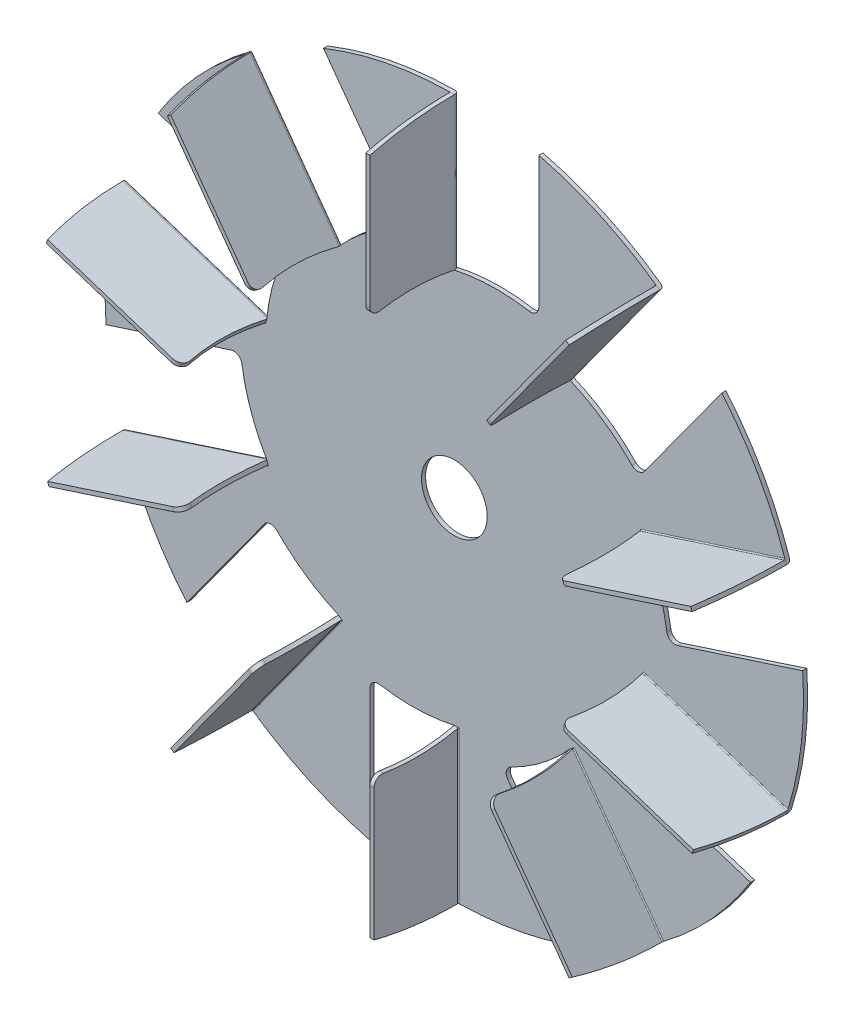
from build123d import *

# Parameters (mm, degrees)
SKETCH1_R           = 4
BOSS_EXTRUDE1_DEPTH = 0.5
BOSS_EXTRUDE2_DEPTH = 0.5
CIRPATTERN1_COUNT   = 10
FILLET1_R           = 1
FILLET2_R           = 1
FILLET3_R           = 0.4
FILLET4_R           = 0.125


with BuildPart() as part:
    # Sketch1 → Boss-Extrude1 (new body)
    with BuildSketch(Plane.XY):
        with BuildLine():
            ThreePointArc((0, 42.5), (-8.109382304, 41.719155297), (-15.92078022, 39.405313819))
            Line((-15.92078022, 39.405313819), (-5.788791749, 25.459828069))
            ThreePointArc((-5.788791749, 25.459828069), (-10.277538194, 22.89193764), (-14.106846055, 19.416407865))
            Line((-14.106846055, 19.416407865), (-24.980873222, 34.383222261))
            ThreePointArc((-24.980873222, 34.383222261), (-31.082532319, 28.984930303), (-36.042044087, 22.52156873))
            Line((-36.042044087, 22.52156873), (-19.648142366, 17.194867163))
            ThreePointArc((-19.648142366, 17.194867163), (-21.7702464, 12.478981204), (-22.825356391, 7.416407865))
            Line((-22.825356391, 7.416407865), (-40.419901943, 13.133222261))
            ThreePointArc((-40.419901943, 13.133222261), (-42.183211445, 5.179447095), (-42.396472136, -2.964650134))
            Line((-42.396472136, -2.964650134), (-26.002570416, 2.362051433))
            ThreePointArc((-26.002570416, 2.362051433), (-24.947460425, -2.700521906), (-22.825356391, -7.416407865))
            Line((-22.825356391, -7.416407865), (-40.419901943, -13.133222261))
            ThreePointArc((-40.419901943, -13.133222261), (-37.171337553, -20.60440886), (-32.556888833, -27.318473412))
            Line((-32.556888833, -27.318473412), (-22.424900361, -13.372987661))
            ThreePointArc((-22.424900361, -13.372987661), (-18.5955925, -16.848517436), (-14.106846055, -19.416407865))
            Line((-14.106846055, -19.416407865), (-24.980873222, -34.383222261))
            ThreePointArc((-24.980873222, -34.383222261), (-17.961276124, -38.518080949), (-10.281680563, -41.237568367))
            Line((-10.281680563, -41.237568367), (-10.281680563, -24))
            ThreePointArc((-10.281680563, -24), (-5.140840281, -24.560951965), (0, -24))
            Line((0, -24), (0, -42.5))
            ThreePointArc((0, -42.5), (8.109382304, -41.719155297), (15.92078022, -39.405313819))
            Line((15.92078022, -39.405313819), (5.788791749, -25.459828069))
            ThreePointArc((5.788791749, -25.459828069), (10.277538194, -22.89193764), (14.106846055, -19.416407865))
            Line((14.106846055, -19.416407865), (24.980873222, -34.383222261))
            ThreePointArc((24.980873222, -34.383222261), (31.082532319, -28.984930303), (36.042044087, -22.52156873))
            Line((36.042044087, -22.52156873), (19.648142366, -17.194867163))
            ThreePointArc((19.648142366, -17.194867163), (21.7702464, -12.478981204), (22.825356391, -7.416407865))
            Line((22.825356391, -7.416407865), (40.419901943, -13.133222261))
            ThreePointArc((40.419901943, -13.133222261), (42.183211445, -5.179447095), (42.396472136, 2.964650134))
            Line((42.396472136, 2.964650134), (26.002570416, -2.362051433))
            ThreePointArc((26.002570416, -2.362051433), (24.947460425, 2.700521906), (22.825356391, 7.416407865))
            Line((22.825356391, 7.416407865), (40.419901943, 13.133222261))
            ThreePointArc((40.419901943, 13.133222261), (37.171337553, 20.60440886), (32.556888833, 27.318473412))
            Line((32.556888833, 27.318473412), (22.424900361, 13.372987661))
            ThreePointArc((22.424900361, 13.372987661), (18.5955925, 16.848517436), (14.106846055, 19.416407865))
            Line((14.106846055, 19.416407865), (24.980873222, 34.383222261))
            ThreePointArc((24.980873222, 34.383222261), (17.961276124, 38.518080949), (10.281680563, 41.237568367))
            Line((10.281680563, 41.237568367), (10.281680563, 24))
            ThreePointArc((10.281680563, 24), (5.140840281, 24.560951965), (0, 24))
            Line((0, 24), (0, 42.5))
        make_face()
        Circle(SKETCH1_R, mode=Mode.SUBTRACT)
    extrude(amount=BOSS_EXTRUDE1_DEPTH)

    # Sketch3 → Boss-Extrude2 (add)
    with BuildSketch(Plane(origin=(0, 0, 0), x_dir=(0, 0, -1), z_dir=(1, 0, 0))):
        with BuildLine():
            Line((-0.5, 42.5), (-0.5, 24))
            ThreePointArc((-0.5, 24), (-5.640840281, 24.560951965), (-10.781680563, 24))
            Line((-10.781680563, 24), (-10.781680563, 41.237568367))
            ThreePointArc((-10.781680563, 41.237568367), (-5.679447095, 42.183211445), (-0.5, 42.5))
        make_face()
    boss_extrude2 = extrude(amount=-BOSS_EXTRUDE2_DEPTH)

    # CirPattern1: Boss-Extrude2 ×10 about axis
    cirpattern1_axis = Axis((0, 0, 10.43304271), (0, 0, -1))
    for i in range(1, CIRPATTERN1_COUNT):
        add(boss_extrude2.rotate(cirpattern1_axis, i * 360 / CIRPATTERN1_COUNT))

    # Fillet1
    fillet1_edges = [part.edges().sort_by_distance(p)[0] for p in [
        (-26.002570416, 2.362051433, 0.25),
        (-22.424900361, -13.372987661, 0.25),
        (-10.281680563, -24, 0.25),
        (5.788791749, -25.459828069, 0.25),
        (19.648142366, -17.194867163, 0.25),
        (26.002570416, -2.362051433, 0.25),
        (22.424900361, 13.372987661, 0.25),
        (10.281680563, 24, 0.25),
        (-5.788791749, 25.459828069, 0.25),
        (-19.648142366, 17.194867163, 0.25),
    ]]
    fillet(fillet1_edges, radius=FILLET1_R)

    # Fillet2
    fillet2_edges = [part.edges().sort_by_distance(p)[0] for p in [
        (-13.904591806, -19.563354178, 10.781680563),
        (0.25, -24, 10.781680563),
        (14.309100304, -19.269461552, 10.781680563),
        (22.90261064, -7.178643736, 10.781680563),
        (22.748102142, 7.654171994, 10.781680563),
        (13.904591806, 19.563354178, 10.781680563),
        (-0.25, 24, 10.781680563),
        (-14.309100304, 19.269461552, 10.781680563),
        (-22.90261064, 7.178643736, 10.781680563),
        (-22.748102142, -7.654171994, 10.781680563),
    ]]
    fillet(fillet2_edges, radius=FILLET2_R)

    # Fillet3
    fillet3_edges = [part.edges().sort_by_distance(p)[0] for p in [
        (-31.622629167, -10.274815063, 0),
        (-19.543859639, -26.899815063, 0),
        (0, -33.25, 0),
        (19.543859639, -26.899815063, 0),
        (31.622629167, -10.274815063, 0),
        (31.622629167, 10.274815063, 0),
        (19.543859639, 26.899815063, 0),
        (0, 33.25, 0),
        (-19.543859639, 26.899815063, 0),
        (-31.622629167, 10.274815063, 0),
    ]]
    fillet(fillet3_edges, radius=FILLET3_R)

    # Fillet4
    fillet4_edges = [part.edges().sort_by_distance(p)[0] for p in [
        (-19.138486722, -27.192517917, 0.5),
        (-31.466722009, -10.749888869, 0.5),
        (-31.775739003, 9.798832352, 0.5),
        (-19.947503716, 26.604732665, 0.5),
        (-0.5, 33.248529361, 0.5),
        (19.138486722, 27.192517917, 0.5),
        (31.466722009, 10.749888869, 0.5),
        (31.775739003, -9.798832352, 0.5),
        (19.947503716, -26.604732665, 0.5),
        (0.5, -33.248529361, 0.5),
    ]]
    fillet(fillet4_edges, radius=FILLET4_R)


solid = part.part
